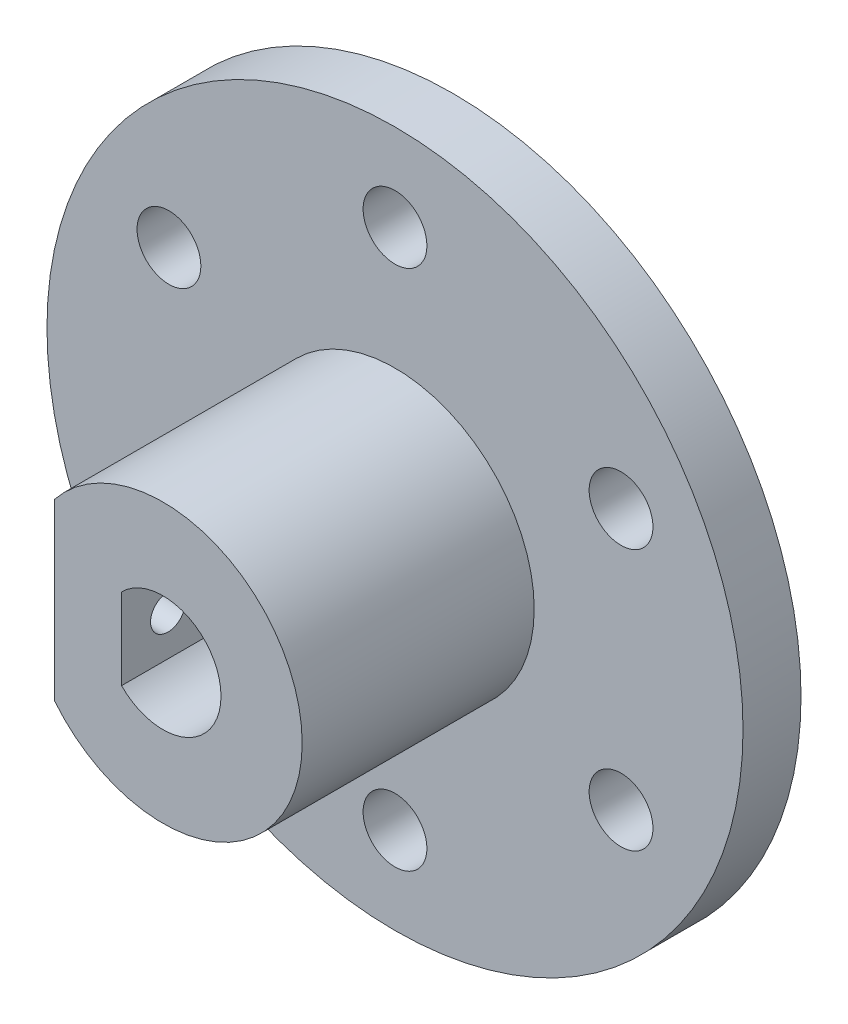
from build123d import *

# Parameters (mm, degrees)
SKETCH_1_R          = 30
SKETCH_1_R_2        = 2.75
EXTRUDE_1_DEPTH     = 5
EXTRUDE_2_DEPTH     = 20
SKETCH_3_R          = 1.5
CUT_EXTRUDE_1_DEPTH = 10


with BuildPart() as part:
    # 草图1 → 凸台-拉伸1 (new body)
    with BuildSketch(Plane.XY):
        Circle(SKETCH_1_R)
        with Locations((0, 22.5)):
            Circle(SKETCH_1_R_2, mode=Mode.SUBTRACT)
        with Locations((19.485571585, 11.25)):
            Circle(SKETCH_1_R_2, mode=Mode.SUBTRACT)
        with Locations((19.485571585, -11.25)):
            Circle(SKETCH_1_R_2, mode=Mode.SUBTRACT)
        with Locations((0, -22.5)):
            Circle(SKETCH_1_R_2, mode=Mode.SUBTRACT)
        with Locations((-19.485571585, -11.25)):
            Circle(SKETCH_1_R_2, mode=Mode.SUBTRACT)
        with Locations((-19.485571585, 11.25)):
            Circle(SKETCH_1_R_2, mode=Mode.SUBTRACT)
    extrude(amount=EXTRUDE_1_DEPTH)

    # 草图2 → 凸台-拉伸2 (add)
    with BuildSketch(Plane.XY.offset(5)):
        with BuildLine():
            Line((-9.367496998, -7.5), (-9.367496998, 7.5))
            ThreePointArc((-9.367496998, 7.5), (12, 0), (-9.367496998, -7.5))
        make_face()
        with BuildLine():
            Line((-3.570714214, 3.5), (-3.570714214, -3.5))
            ThreePointArc((-3.570714214, -3.5), (5, 0), (-3.570714214, 3.5))
        make_face(mode=Mode.SUBTRACT)
    extrude(amount=EXTRUDE_2_DEPTH)

    # 草图3 → 切除-拉伸1 (cut)
    with BuildSketch(Plane.ZY.offset(9.367496998)):
        with Locations((21, 0)):
            Circle(SKETCH_3_R)
        with Locations((15, 0)):
            Circle(SKETCH_3_R)
    extrude(amount=-CUT_EXTRUDE_1_DEPTH, mode=Mode.SUBTRACT)


solid = part.part
